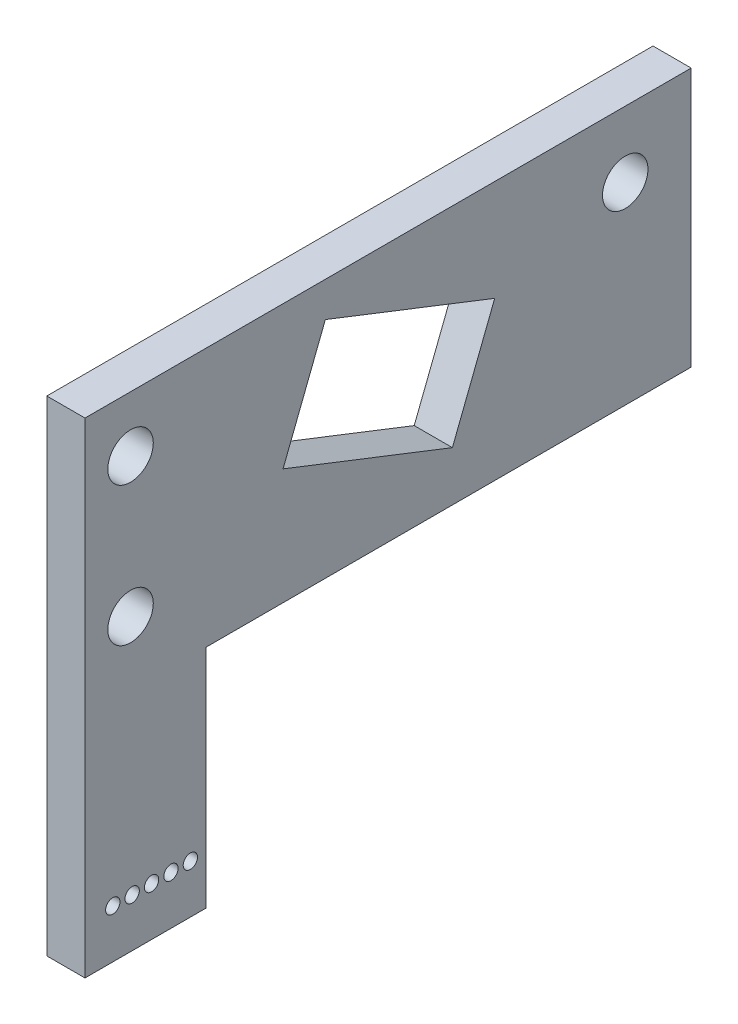
from build123d import *

# Parameters (mm, degrees)
SKETCH1_R           = 2.38125
SKETCH1_R_2         = 0.75
BOSS_EXTRUDE1_DEPTH = 2


with BuildPart() as part:
    # Sketch1 → Boss-Extrude1 (new, symmetric)
    with BuildSketch(Plane(origin=(0, 0, 0), x_dir=(0, 0, -1), z_dir=(1, 0, 0))):
        Polygon((6.909587278, 6.909587278), (-56.590412722, 6.909587278), (-56.590412722, -43.890412722), (-43.890412722, -43.890412722), (-43.890412722, -20.222057583), (6.909587278, -20.222057583), align=None)
        Circle(SKETCH1_R, mode=Mode.SUBTRACT)
        with Locations((-45.552958224, -38.810412722)):
            Circle(SKETCH1_R_2, mode=Mode.SUBTRACT)
        with Locations((-47.584958224, -38.810412722)):
            Circle(SKETCH1_R_2, mode=Mode.SUBTRACT)
        with Locations((-49.616958224, -38.810412722)):
            Circle(SKETCH1_R_2, mode=Mode.SUBTRACT)
        with Locations((-51.648958224, -38.810412722)):
            Circle(SKETCH1_R_2, mode=Mode.SUBTRACT)
        with Locations((-51.818112153, -13.484149416)):
            Circle(SKETCH1_R, mode=Mode.SUBTRACT)
        with Locations((-51.818112153, 1.079375692)):
            Circle(SKETCH1_R, mode=Mode.SUBTRACT)
        with Locations((-53.680958224, -38.810412722)):
            Circle(SKETCH1_R_2, mode=Mode.SUBTRACT)
        Polygon((-31.413305249, 3.250726227), (-13.673130295, -3.691081364), (-18.105513832, -15.018283734), (-35.845688785, -8.076476144), align=None, mode=Mode.SUBTRACT)
    extrude(amount=BOSS_EXTRUDE1_DEPTH, both=True)


solid = part.part
